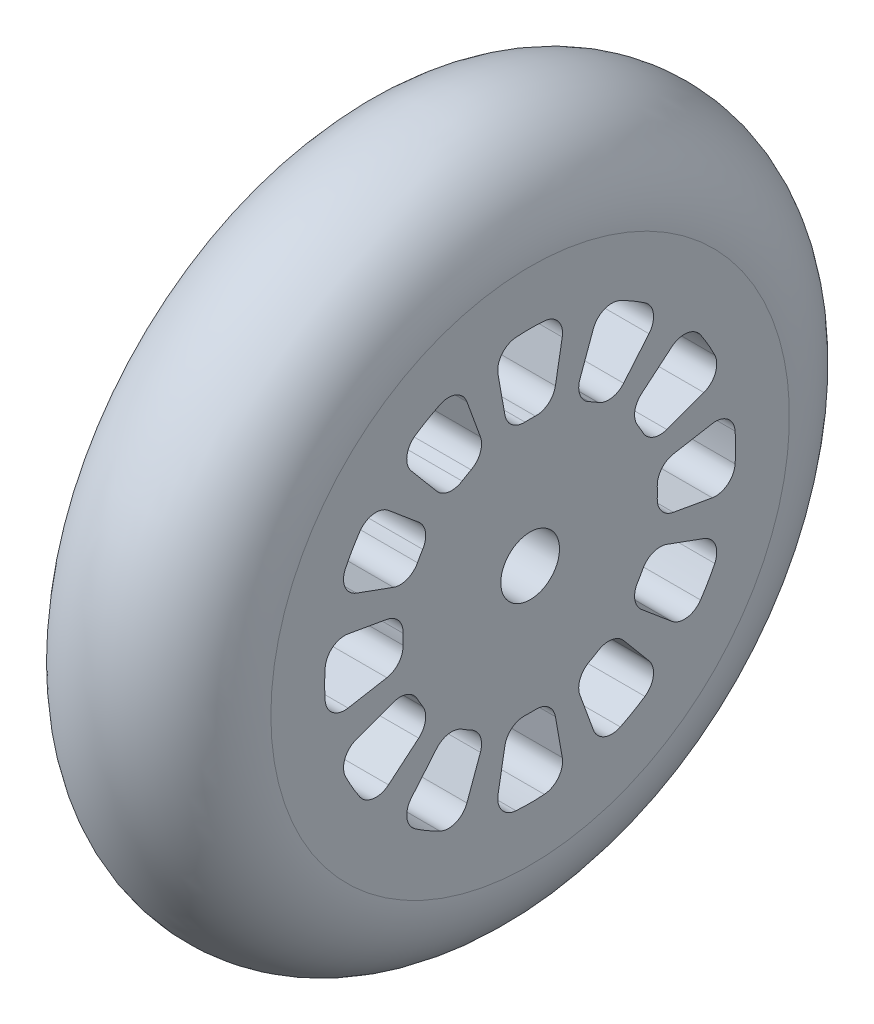
from build123d import *

# Parameters (mm, degrees)
CUT_EXTRUDE1_REACH             = 53.79
SKETCH5_R                      = 3
CUT_EXTRUDE1_DIRECTION_2_REACH = 53.79
CUT_EXTRUDE2_DEPTH             = 52.790443273
FILLET1_R                      = 2
CIRPATTERN2_COUNT              = 12
FILLET1_OF_CIRPATTERN2_R       = 2


with BuildPart() as part:
    # Sketch3 → Revolve1 (revolve)
    with BuildSketch(Plane.XY, mode=Mode.PRIVATE) as revolve1_sk:
        with BuildLine():
            Line((9.5, 0), (9.5, 26.5))
            ThreePointArc((9.5, 26.5), (0, 36), (-9.5, 26.5))
            Line((-9.5, 26.5), (-9.5, 0))
            Line((-9.5, 0), (9.5, 0))
        make_face()
    revolve(revolve1_sk.sketch.rotate(Axis((-15.081723319, 0, 0), (1, 0, 0)), 90), axis=Axis((-15.081723319, 0, 0), (1, 0, 0)))

    # Sketch5 → Cut-Extrude1 (cut, up to next)
    with BuildSketch(Plane(origin=(0, 0, 0), x_dir=(0, 0, -1), z_dir=(1, 0, 0)), mode=Mode.PRIVATE) as cut_extrude1_sk1:
        with Locations(Location((0, 0, 0), (0, 0, 180))):
            Circle(SKETCH5_R)
    cut_extrude1_tool1 = extrude(cut_extrude1_sk1.sketch, amount=-CUT_EXTRUDE1_REACH, mode=Mode.PRIVATE) & part.part
    add(cut_extrude1_tool1.solids().sort_by_distance((0, 0, 0))[0], mode=Mode.SUBTRACT)

    # Sketch5 → Cut-Extrude1 direction 2 (cut, up to next)
    with BuildSketch(Plane(origin=(0, 0, 0), x_dir=(0, 0, -1), z_dir=(1, 0, 0)), mode=Mode.PRIVATE) as cut_extrude1_direction_2_sk1:
        with Locations(Location((0, 0, 0), (0, 0, 180))):
            Circle(SKETCH5_R)
    cut_extrude1_direction_2_tool1 = extrude(cut_extrude1_direction_2_sk1.sketch, amount=CUT_EXTRUDE1_DIRECTION_2_REACH, mode=Mode.PRIVATE) & part.part
    add(cut_extrude1_direction_2_tool1.solids().sort_by_distance((0, 0, 0))[0], mode=Mode.SUBTRACT)

    # Sketch6 → Cut-Extrude2 (cut, symmetric)
    with BuildSketch(Plane(origin=(0, 0, 0), x_dir=(0, 0, -1), z_dir=(1, 0, 0))):
        with BuildLine():
            Line((-3.646611731, 20.680962813), (-2.25742631, 12.802500789))
            ThreePointArc((-2.25742631, 12.802500789), (0, 13), (2.25742631, 12.802500789))
            Line((2.25742631, 12.802500789), (3.646611731, 20.680962813))
            ThreePointArc((3.646611731, 20.680962813), (0, 21), (-3.646611731, 20.680962813))
        make_face()
    cut_extrude2 = extrude(amount=CUT_EXTRUDE2_DEPTH, both=True, mode=Mode.SUBTRACT)

    # Fillet1
    fillet1_edges = [part.edges().sort_by_distance(p)[0] for p in [
        (0, 20.680962813, 3.646611731),
        (0, 20.680962813, -3.646611731),
        (0, 12.802500789, -2.25742631),
        (0, 12.802500789, 2.25742631),
    ]]
    fillet(fillet1_edges, radius=FILLET1_R)

    # CirPattern2: Cut-Extrude2 ×12 about axis
    cirpattern2_axis = Axis((0, 0, 0), (1, 0, 0))
    for i in range(1, CIRPATTERN2_COUNT):
        add(cut_extrude2.rotate(cirpattern2_axis, i * 360 / CIRPATTERN2_COUNT), mode=Mode.SUBTRACT)

    # Fillet1 of CirPattern2
    fillet1_of_cirpattern2_edges = [part.edges().sort_by_distance(p)[0] for p in [
        (0, 16.086933305, 13.498539803),
        (0, 19.733545037, 7.18242301),
        (0, 12.21600407, 4.446261863),
        (0, 9.958577761, 8.356238926),
        (0, 7.18242301, 19.733545037),
        (0, 13.498539803, 16.086933305),
        (0, 8.356238926, 9.958577761),
        (0, 4.446261863, 12.21600407),
        (0, -3.646611731, 20.680962813),
        (0, 3.646611731, 20.680962813),
        (0, 2.25742631, 12.802500789),
        (0, -2.25742631, 12.802500789),
        (0, -13.498539803, 16.086933305),
        (0, -7.18242301, 19.733545037),
        (0, -4.446261863, 12.21600407),
        (0, -8.356238926, 9.958577761),
        (0, -19.733545037, 7.18242301),
        (0, -16.086933305, 13.498539803),
        (0, -9.958577761, 8.356238926),
        (0, -12.21600407, 4.446261863),
        (0, -20.680962813, -3.646611731),
        (0, -20.680962813, 3.646611731),
        (0, -12.802500789, 2.25742631),
        (0, -12.802500789, -2.25742631),
        (0, -16.086933305, -13.498539803),
        (0, -19.733545037, -7.18242301),
        (0, -12.21600407, -4.446261863),
        (0, -9.958577761, -8.356238926),
        (0, -7.18242301, -19.733545037),
        (0, -13.498539803, -16.086933305),
        (0, -8.356238926, -9.958577761),
        (0, -4.446261863, -12.21600407),
        (0, 3.646611731, -20.680962813),
        (0, -3.646611731, -20.680962813),
        (0, -2.25742631, -12.802500789),
        (0, 2.25742631, -12.802500789),
        (0, 13.498539803, -16.086933305),
        (0, 7.18242301, -19.733545037),
        (0, 4.446261863, -12.21600407),
        (0, 8.356238926, -9.958577761),
        (0, 19.733545037, -7.18242301),
        (0, 16.086933305, -13.498539803),
        (0, 9.958577761, -8.356238926),
        (0, 12.21600407, -4.446261863),
    ]]
    fillet(fillet1_of_cirpattern2_edges, radius=FILLET1_OF_CIRPATTERN2_R)


solid = part.part
